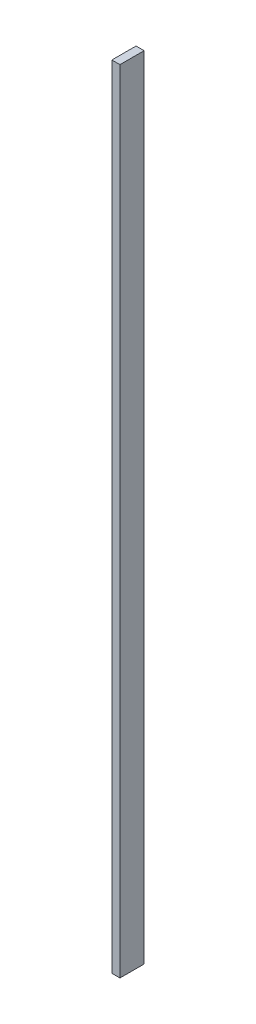
from build123d import *

# Parameters (mm, degrees)
SKETCH1_W           = 38.1
SKETCH1_H           = 1244.6
BOSS_EXTRUDE1_DEPTH = 6.35


with BuildPart() as part:
    # Sketch1 → Boss-Extrude1 (new, symmetric)
    with BuildSketch(Plane(origin=(0, 0, 0), x_dir=(0, 0, -1), z_dir=(1, 0, 0))):
        Rectangle(SKETCH1_W, SKETCH1_H)
    extrude(amount=BOSS_EXTRUDE1_DEPTH, both=True)


solid = part.part
